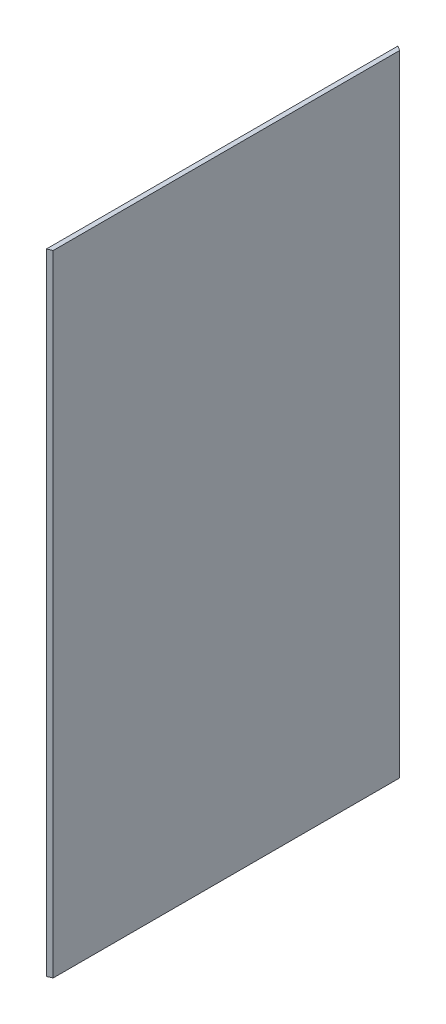
from build123d import *

# Parameters (mm, degrees)
EXTRUDE_1_DEPTH = 533


with BuildPart() as part:
    # Эскиз1 → Вытянуть1 (new body)
    with BuildSketch(Plane(origin=(0, 0, 0), x_dir=(1, 0, 0), z_dir=(0, 1, 0))):
        Polygon((0, 0), (4, 1.764508657), (4, 294.827324918), (0, 297.387590837), align=None)
    extrude(amount=EXTRUDE_1_DEPTH)


solid = part.part
